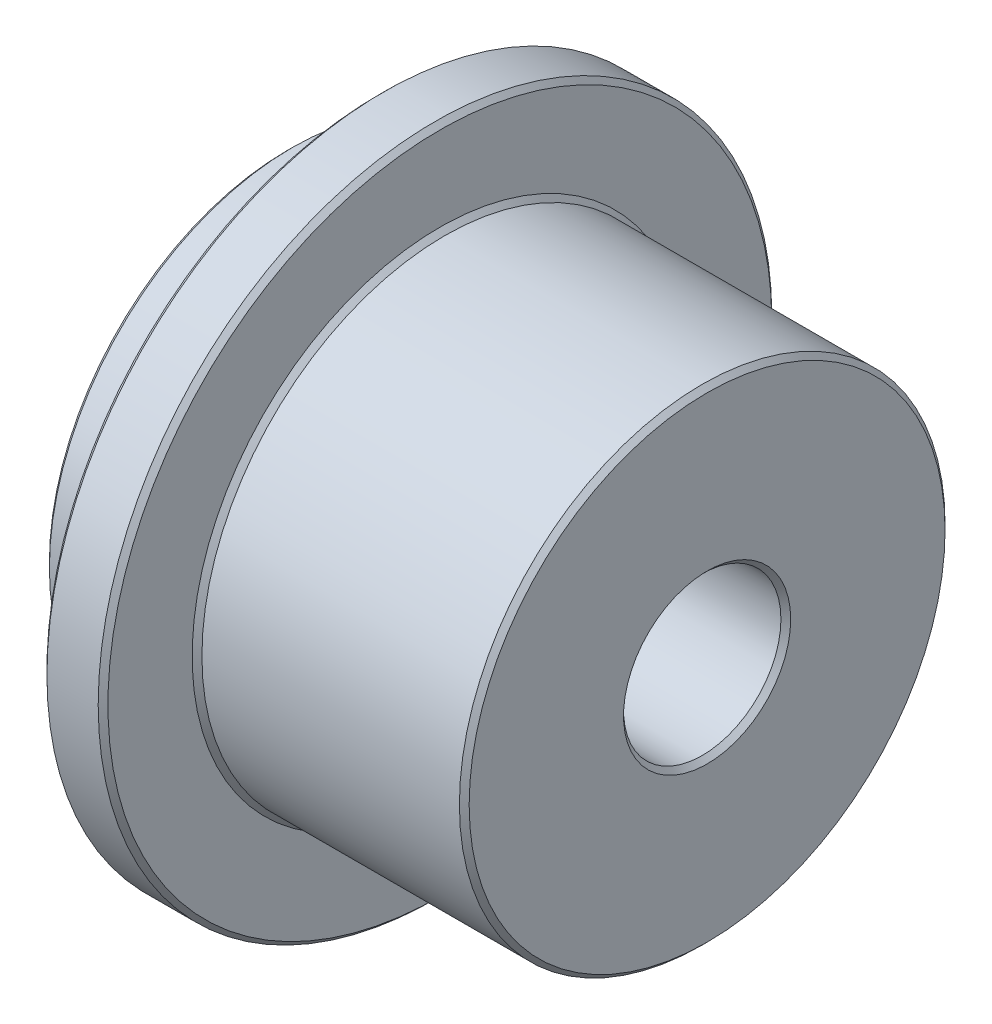
from build123d import *

# Parameters (mm, degrees)
SKETCH1_R           = 12.6365
BOSS_EXTRUDE1_DEPTH = 21.844
SKETCH2_R           = 17.526
BOSS_EXTRUDE2_DEPTH = 3.175
CHAMFER1_SIZE       = 0.254
SKETCH3_R           = 4.09575
CUT_EXTRUDE1_DEPTH  = 34.037579936
CHAMFER2_SIZE       = 0.254


with BuildPart() as part:
    # Sketch1 → Boss-Extrude1 (new body)
    with BuildSketch(Plane(origin=(0, 0, 0), x_dir=(0, 0, -1), z_dir=(1, 0, 0))):
        Circle(SKETCH1_R)
    extrude(amount=BOSS_EXTRUDE1_DEPTH)

    # Sketch2 → Boss-Extrude2 (add)
    with BuildSketch(Plane(origin=(7.9375, 0, 0), x_dir=(0, 0, -1), z_dir=(1, 0, 0))):
        Circle(SKETCH2_R)
    extrude(amount=-BOSS_EXTRUDE2_DEPTH)

    # Chamfer1
    chamfer1_edges = [part.edges().sort_by_distance(p)[0] for p in [
        (0, 0, 12.6365),
        (21.844, 0, 12.6365),
        (4.7625, 0, 12.6365),
        (7.9375, 0, 12.6365),
        (4.7625, 0, 17.526),
        (7.9375, 0, 17.526),
    ]]
    chamfer(chamfer1_edges, length=CHAMFER1_SIZE)

    # Sketch3 → Cut-Extrude1 (cut, through all)
    with BuildSketch(Plane(origin=(21.844, 0, 0), x_dir=(0, 0, -1), z_dir=(1, 0, 0))):
        Circle(SKETCH3_R)
    extrude(amount=-CUT_EXTRUDE1_DEPTH, mode=Mode.SUBTRACT)

    # Chamfer2
    chamfer2_edges = [part.edges().sort_by_distance(p)[0] for p in [
        (0, 0, 4.09575),
        (21.844, 0, 4.09575),
    ]]
    chamfer(chamfer2_edges, length=CHAMFER2_SIZE)


solid = part.part
